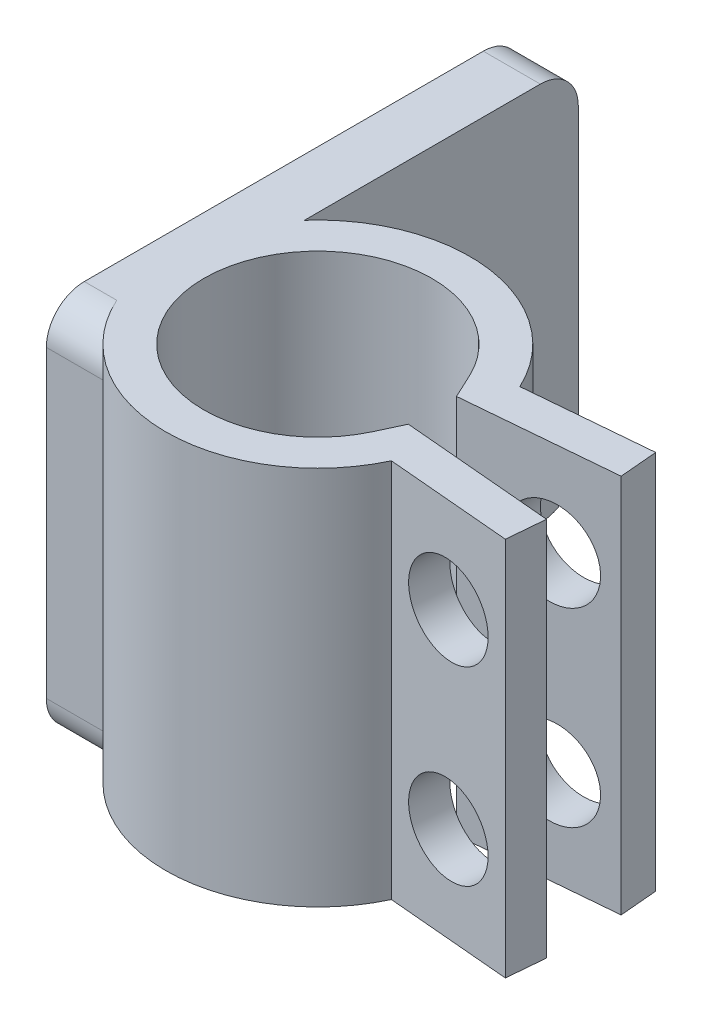
from build123d import *

# Parameters (mm, degrees)
BOSS_EXTRUDE1_DEPTH = 25.4
CUT_EXTRUDE1_REACH  = 52.064
SKETCH2_R           = 3.175
FILLET1_R           = 2.54
CUT_EXTRUDE2_REACH  = 47.354
SKETCH3_R           = 2.921
CUT_EXTRUDE3_REACH  = 49.286
SKETCH4_R           = 2.921


with BuildPart() as part:
    # Sketch1 → Boss-Extrude1 (new body)
    with BuildSketch(Plane(origin=(0, 0, 0), x_dir=(1, 0, 0), z_dir=(0, 1, 0))):
        with BuildLine():
            Line((0, 0), (0, 31.75))
            Line((0, 31.75), (3.81, 31.75))
            Line((3.81, 31.75), (3.81, 13.44041666))
            ThreePointArc((3.81, 13.44041666), (12.879954362, 16.776213121), (20.638087116, 11.014009869))
            Line((20.638087116, 11.014009869), (28.987665935, 11.744503361))
            Line((28.987665935, 11.744503361), (29.209041521, 9.214168828))
            Line((29.209041521, 9.214168828), (19.087703389, 8.328666482))
            Line((19.087703389, 8.328666482), (18.336065337, 9.940559485))
            ThreePointArc((18.336065337, 9.940559485), (9.780730142, 14.159583904), (3.81, 6.72020833))
            ThreePointArc((3.81, 6.72020833), (9.780730142, -0.719167244), (18.336065337, 3.499857176))
            Line((18.336065337, 3.499857176), (19.087703389, 5.111750178))
            Line((19.087703389, 5.111750178), (29.209041521, 4.226247832))
            Line((29.209041521, 4.226247832), (28.987665935, 1.695913299))
            Line((28.987665935, 1.695913299), (20.638087116, 2.426406791))
            ThreePointArc((20.638087116, 2.426406791), (12.879954362, -3.335796461), (3.81, 0))
            Line((3.81, 0), (0, 0))
        make_face()
    extrude(amount=BOSS_EXTRUDE1_DEPTH)

    # Sketch2 → Cut-Extrude1 (cut, up to next)
    with BuildSketch(Plane.ZY, mode=Mode.PRIVATE) as cut_extrude1_sk1:
        with Locations((-21.59, 12.7)):
            Circle(SKETCH2_R)
    cut_extrude1_tool1 = extrude(cut_extrude1_sk1.sketch, amount=-CUT_EXTRUDE1_REACH, mode=Mode.PRIVATE) & part.part
    add(cut_extrude1_tool1.solids().sort_by_distance((0, 12.7, -21.59))[0], mode=Mode.SUBTRACT)

    # Fillet1
    fillet1_edges = [part.edges().sort_by_distance(p)[0] for p in [
        (1.905, 0, -31.75),
        (1.905, 0, 0),
        (1.905, 25.4, 0),
        (1.905, 25.4, -31.75),
    ]]
    fillet(fillet1_edges, radius=FILLET1_R)

    # Sketch3 → Cut-Extrude2 (cut, up to next)
    with BuildSketch(Plane(origin=(-0.799511913, 0, -9.138462981), x_dir=(-0.996194698091745, 0, 0.08715574274766381), z_dir=(-0.08715574274766381, 0, -0.9961946980917451)), mode=Mode.PRIVATE) as cut_extrude2_sk1:
        with Locations((-25.710223601, 19.05)):
            Circle(SKETCH3_R)
    cut_extrude2_tool1 = extrude(cut_extrude2_sk1.sketch, amount=-CUT_EXTRUDE2_REACH, mode=Mode.PRIVATE) & part.part
    # Sketch3 → Cut-Extrude2 (cut, up to next)
    with BuildSketch(Plane(origin=(-0.799511913, 0, -9.138462981), x_dir=(-0.996194698091745, 0, 0.08715574274766381), z_dir=(-0.08715574274766381, 0, -0.9961946980917451)), mode=Mode.PRIVATE) as cut_extrude2_sk2:
        with Locations((-25.710223601, 6.35)):
            Circle(SKETCH3_R)
    cut_extrude2_tool2 = extrude(cut_extrude2_sk2.sketch, amount=-CUT_EXTRUDE2_REACH, mode=Mode.PRIVATE) & part.part
    add(cut_extrude2_tool1.solids().sort_by_distance((24.812877, 19.05, -11.379257))[0], mode=Mode.SUBTRACT)
    add(cut_extrude2_tool2.solids().sort_by_distance((24.812877, 6.35, -11.379257))[0], mode=Mode.SUBTRACT)

    # Sketch4 → Cut-Extrude3 (cut, up to next)
    with BuildSketch(Plane(origin=(0.367440017, 0, -4.199858614), x_dir=(0.9961946980917455, 0, 0.0871557427476594), z_dir=(-0.0871557427476594, 0, 0.9961946980917455)), mode=Mode.PRIVATE) as cut_extrude3_sk1:
        with Locations((24.538814104, 19.05)):
            Circle(SKETCH4_R)
    cut_extrude3_tool1 = extrude(cut_extrude3_sk1.sketch, amount=-CUT_EXTRUDE3_REACH, mode=Mode.PRIVATE) & part.part
    # Sketch4 → Cut-Extrude3 (cut, up to next)
    with BuildSketch(Plane(origin=(0.367440017, 0, -4.199858614), x_dir=(0.9961946980917455, 0, 0.0871557427476594), z_dir=(-0.0871557427476594, 0, 0.9961946980917455)), mode=Mode.PRIVATE) as cut_extrude3_sk2:
        with Locations((24.538814104, 6.35)):
            Circle(SKETCH4_R)
    cut_extrude3_tool2 = extrude(cut_extrude3_sk2.sketch, amount=-CUT_EXTRUDE3_REACH, mode=Mode.PRIVATE) & part.part
    add(cut_extrude3_tool1.solids().sort_by_distance((24.812877, 19.05, -2.06116))[0], mode=Mode.SUBTRACT)
    add(cut_extrude3_tool2.solids().sort_by_distance((24.812877, 6.35, -2.06116))[0], mode=Mode.SUBTRACT)


solid = part.part
